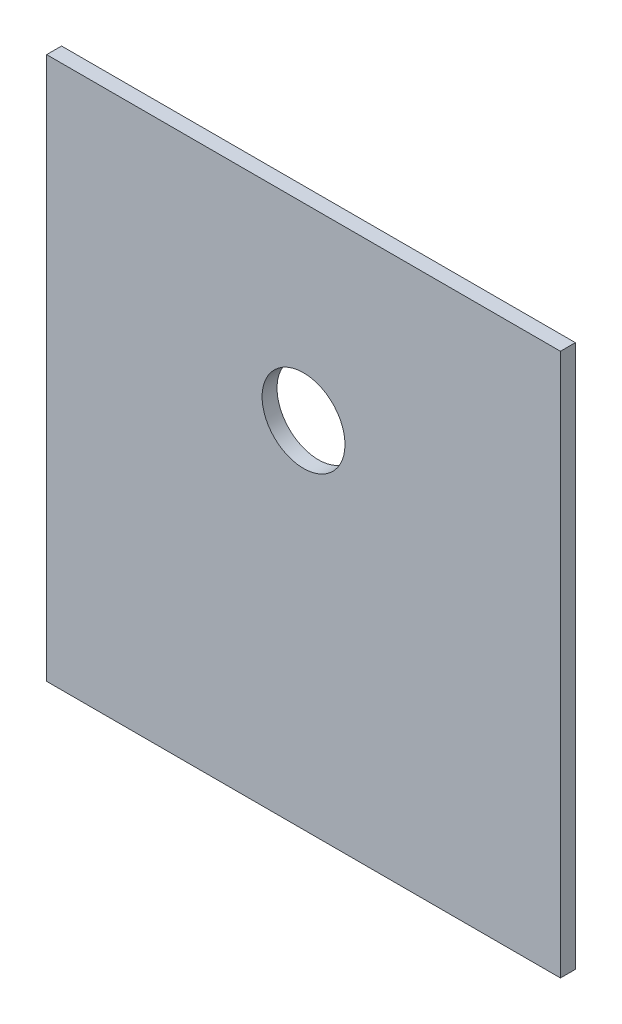
from build123d import *

# Parameters (mm, degrees)
SKETCH1_W           = 62
SKETCH1_H           = 65.5
BOSS_EXTRUDE1_DEPTH = 0.9
SKETCH2_R           = 5
CUT_EXTRUDE1_DEPTH  = 46.130948361


with BuildPart() as part:
    # Sketch1 → Boss-Extrude1 (new, symmetric)
    with BuildSketch(Plane.XY):
        Rectangle(SKETCH1_W, SKETCH1_H)
    extrude(amount=BOSS_EXTRUDE1_DEPTH, both=True)

    # Sketch2 → Cut-Extrude1 (cut, through all)
    with BuildSketch(Plane.XY.offset(0.9)):
        with Locations((0, 10)):
            Circle(SKETCH2_R)
    extrude(amount=-CUT_EXTRUDE1_DEPTH, mode=Mode.SUBTRACT)


solid = part.part
